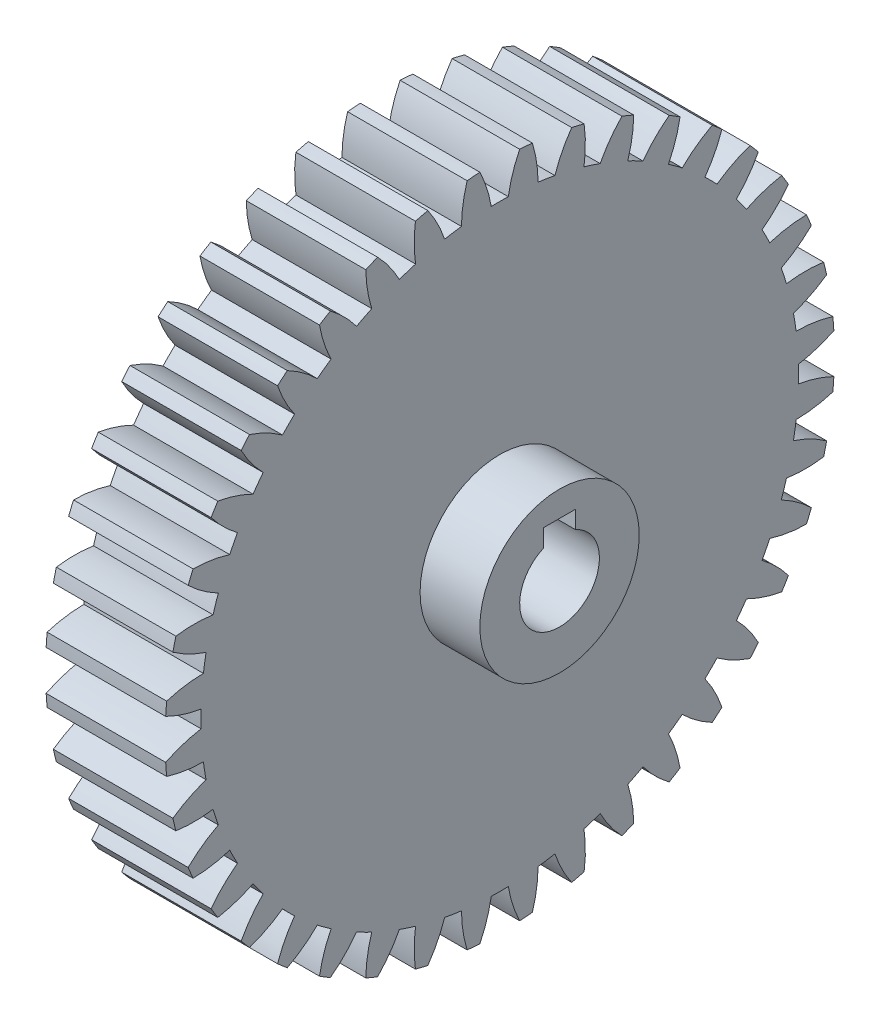
from build123d import *

# Parameters (mm, degrees)
BASPROSKE_W       = 15
BASPROSKE_H       = 42
TOOTHCUT_DEPTH    = 62.26173357
TEETHCUTS_COUNT   = 40
TEETHCUTS_ANGLE   = 351
HUBNEABOTSKE_R    = 10
HUBNEARBOTH_DEPTH = 7.5000254
HUBFAR_START      = 7.5000254
HUBFARSKE_R       = 10
HUBFAR_DEPTH      = 7.5000254
BORSKE_R          = 5
BORE_DEPTH        = 30.0000508
KEYSKE_W          = 4
KEYSKE_H          = 6.8
KEYWAY_DEPTH      = 30.0000508


with BuildPart() as part:
    # BasProSke → Base-Revolve (revolve)
    with BuildSketch(Plane(origin=(0, 0, 0), x_dir=(1, 0, 0), z_dir=(0, 1, 0)), mode=Mode.PRIVATE) as base_revolve_sk:
        with Locations((7.5, 21)):
            Rectangle(BASPROSKE_W, BASPROSKE_H)
    revolve(base_revolve_sk.sketch.rotate(Axis((-10, 0, 0), (1, 0, 0)), 180), axis=Axis((-10, 0, 0), (1, 0, 0)))

    # TooCutSke → ToothCut (cut, through all)
    with BuildSketch(Plane(origin=(0, 0, 0), x_dir=(0, 0, -1), z_dir=(1, 0, 0))):
        with BuildLine():
            ThreePointArc((1.069221139, 37.483753376), (0, 37.499), (-1.069221139, 37.483753376))
            ThreePointArc((-1.069221139, 37.483753376), (-1.623716038, 39.770155553), (-2.507504748, 41.950526398))
            ThreePointArc((-2.507504748, 41.950526398), (0, 42.0254), (2.507504748, 41.950526398))
            ThreePointArc((2.507504748, 41.950526398), (1.623716038, 39.770155553), (1.069221139, 37.483753376))
        make_face()
    toothcut = extrude(amount=TOOTHCUT_DEPTH, mode=Mode.SUBTRACT)

    # TeethCuts: ToothCut ×40 about axis
    teethcuts_axis = Axis((-10, 0, 0), (1, 0, 0))
    for i in range(1, TEETHCUTS_COUNT):
        add(toothcut.rotate(teethcuts_axis, i * TEETHCUTS_ANGLE / (TEETHCUTS_COUNT - 1)), mode=Mode.SUBTRACT)

    # HubNeaBotSke → HubNearBoth (add)
    with BuildSketch(Plane.ZY):
        with Locations(Location((0, 0, 0), (0, 0, 180))):
            Circle(HUBNEABOTSKE_R)
    extrude(amount=HUBNEARBOTH_DEPTH)

    # HubFarSke → HubFar (add)
    with BuildSketch(Plane(origin=(15, 0, 0), x_dir=(0, 0, -1), z_dir=(1, 0, 0)).offset(HUBFAR_START)):
        Circle(HUBFARSKE_R)
    extrude(amount=-HUBFAR_DEPTH)

    # BorSke → Bore (cut, symmetric)
    with BuildSketch(Plane(origin=(0, 0, 0), x_dir=(0, 0, -1), z_dir=(1, 0, 0))):
        with Locations(Location((0, 0, 0), (0, 0, 180))):
            Circle(BORSKE_R)
    extrude(amount=BORE_DEPTH, both=True, mode=Mode.SUBTRACT)

    # KeySke → Keyway (cut, symmetric)
    with BuildSketch(Plane(origin=(0, 0, 0), x_dir=(0, 0, -1), z_dir=(1, 0, 0))):
        with Locations((0, 3.4)):
            Rectangle(KEYSKE_W, KEYSKE_H)
    extrude(amount=KEYWAY_DEPTH, both=True, mode=Mode.SUBTRACT)


solid = part.part
